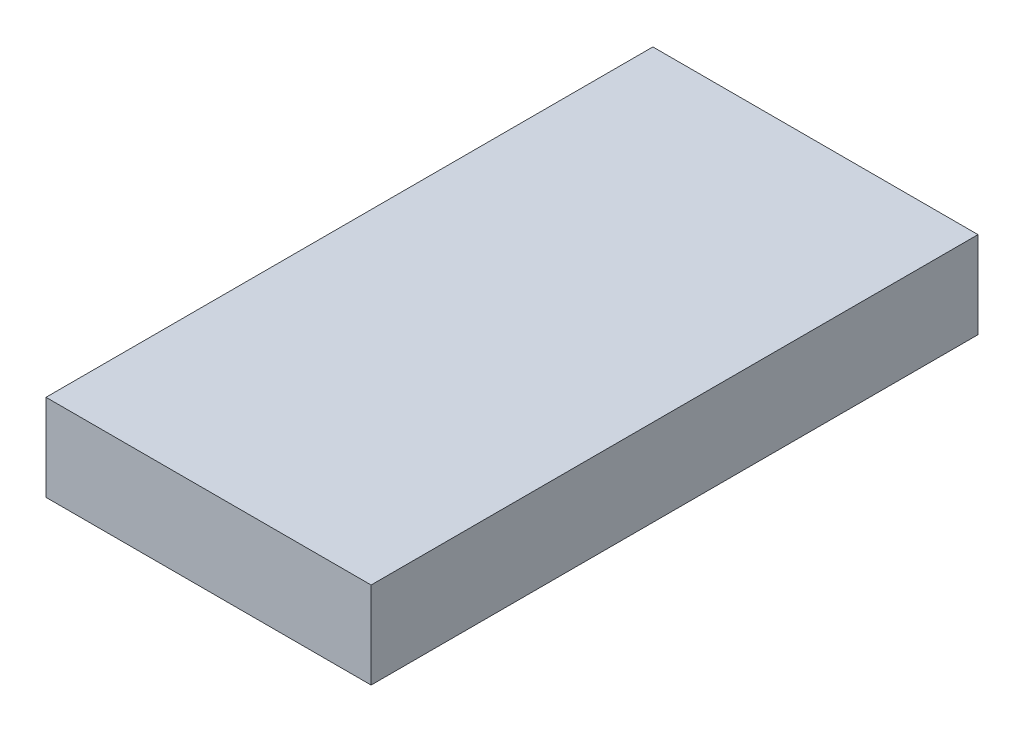
from build123d import *

# Parameters (mm, degrees)
SKETCH1_W           = 150
SKETCH1_H           = 280
BOSS_EXTRUDE1_DEPTH = 40


with BuildPart() as part:
    # Sketch1 → Boss-Extrude1 (new body)
    with BuildSketch(Plane(origin=(0, 0, 0), x_dir=(1, 0, 0), z_dir=(0, 1, 0))):
        Rectangle(SKETCH1_W, SKETCH1_H)
    extrude(amount=BOSS_EXTRUDE1_DEPTH)


solid = part.part
